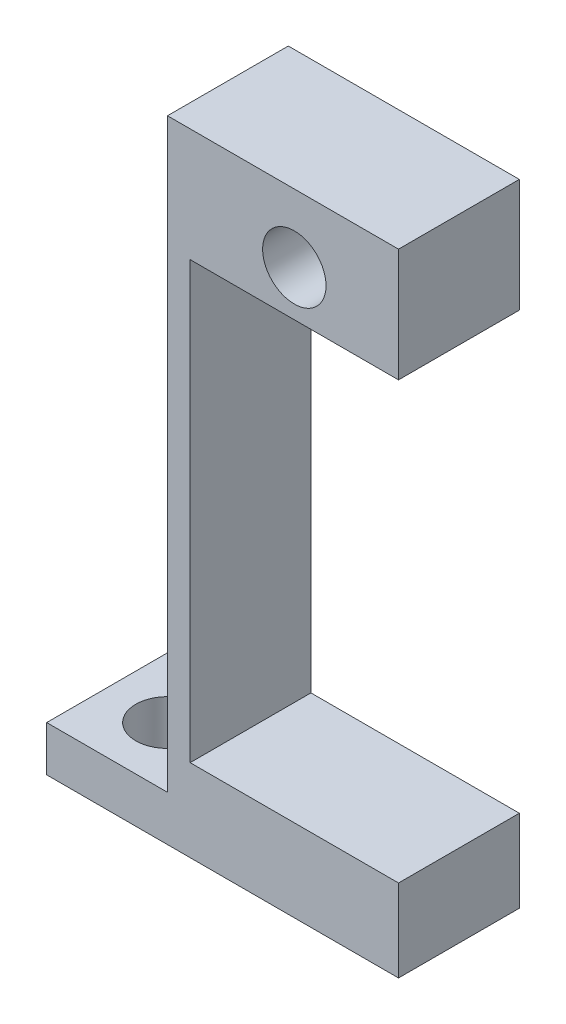
from build123d import *
from build123d.topology import SkipClean

# Parameters (mm, degrees)
SKETCH1_W            = 8
SKETCH1_H            = 8
SKETCH1_R            = 2.1
BOSS_EXTRUDE6_DEPTH  = 1.5
SKETCH6_W            = 8
SKETCH6_H            = 1.5
BOSS_EXTRUDE7_DEPTH  = 15.3
BOSS_EXTRUDE8_START  = 1.5
SKETCH10_W           = 8
SKETCH10_H           = 8
SKETCH10_R           = 2.1
BOSS_EXTRUDE8_DEPTH  = 1.5
SKETCH11_W           = 1.5
SKETCH11_H           = 8
BOSS_EXTRUDE9_DEPTH  = 40.3
SKETCH12_W           = 8
SKETCH12_H           = 7.5
BOSS_EXTRUDE10_DEPTH = 13.8
SKETCH14_R           = 2.1
CUT_EXTRUDE1_DEPTH   = 13.8
SKETCH15_W           = 13.8
SKETCH15_H           = 8
BOSS_EXTRUDE11_DEPTH = 3.95


with BuildPart() as part:
    # Sketch1 → Boss-Extrude6 (new body)
    with BuildSketch(Plane(origin=(0, 0, 0), x_dir=(1, 0, 0), z_dir=(0, 1, 0))):
        with Locations((-4, -4)):
            Rectangle(SKETCH1_W, SKETCH1_H)
        with Locations(Location((-4, -4, 0), (0, 0, 270))):
            Circle(SKETCH1_R, mode=Mode.SUBTRACT)
    extrude(amount=BOSS_EXTRUDE6_DEPTH)



with BuildPart() as body_2:
    # Sketch6 → Boss-Extrude7 (new body)
    with BuildSketch(Plane(origin=(0, 0, 0), x_dir=(0, 0, -1), z_dir=(1, 0, 0))):
        with Locations((-4, -0.75)):
            Rectangle(SKETCH6_W, SKETCH6_H)
    extrude(amount=BOSS_EXTRUDE7_DEPTH)


with BuildPart() as part_1:
    with SkipClean():  # the faces are left unmerged after this step: merging them gives an invalid solid
        add(part.part)

        add(body_2.part)  # Boss-Extrude8 merges body 2
        # Sketch10 → Boss-Extrude8 (add)
        with BuildSketch(Plane.XZ.offset(BOSS_EXTRUDE8_START)):
            with Locations((-4, 4)):
                Rectangle(SKETCH10_W, SKETCH10_H)
            with Locations(Location((-4, 4, 0), (0, 0, 270))):
                Circle(SKETCH10_R, mode=Mode.SUBTRACT)
        extrude(amount=-BOSS_EXTRUDE8_DEPTH)

    # Sketch11 → Boss-Extrude9 (add)
    with SkipClean():  # the faces are left unmerged after this step: merging them gives an invalid solid
        with BuildSketch(Plane(origin=(0, 0, 0), x_dir=(1, 0, 0), z_dir=(0, 1, 0))):
            with Locations((0.75, -4)):
                Rectangle(SKETCH11_W, SKETCH11_H)
        extrude(amount=BOSS_EXTRUDE9_DEPTH)

    # Sketch12 → Boss-Extrude10 (add)
    with SkipClean():  # the faces are left unmerged after this step: merging them gives an invalid solid
        with BuildSketch(Plane(origin=(1.5, 0, 0), x_dir=(0, 0, -1), z_dir=(1, 0, 0))):
            with Locations((-4, 36.55)):
                Rectangle(SKETCH12_W, SKETCH12_H)
        extrude(amount=BOSS_EXTRUDE10_DEPTH)

    # Sketch14 → Cut-Extrude1 (cut)
    with SkipClean():  # the faces are left unmerged after this step: merging them gives an invalid solid
        with BuildSketch(Plane.XY.offset(8)):
            with Locations((8.4, 35.8)):
                Circle(SKETCH14_R)
        extrude(amount=-CUT_EXTRUDE1_DEPTH, mode=Mode.SUBTRACT)

    # Sketch15 → Boss-Extrude11 (add)
    with SkipClean():  # the faces are left unmerged after this step: merging them gives an invalid solid
        with BuildSketch(Plane(origin=(0, 0, 0), x_dir=(1, 0, 0), z_dir=(0, 1, 0))):
            with Locations((8.4, -4)):
                Rectangle(SKETCH15_W, SKETCH15_H)
        extrude(amount=BOSS_EXTRUDE11_DEPTH)


solid = part_1.part
